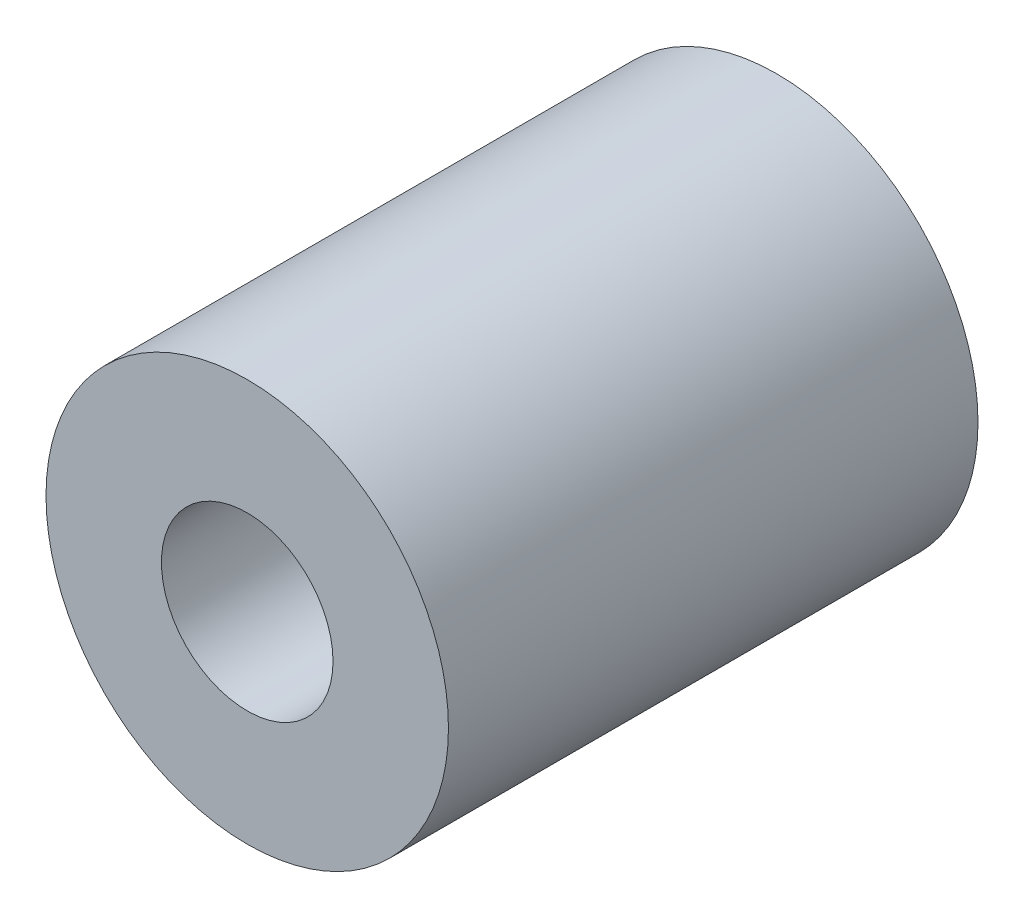
from build123d import *

# Parameters (mm, degrees)
CROQUIS1_R              = 9.5
SALIENTE_EXTRUIR1_DEPTH = 25
CROQUIS2_R              = 4.05
CORTAR_EXTRUIR1_DEPTH   = 29.381331893


with BuildPart() as part:
    # Croquis1 → Saliente-Extruir1 (new body)
    with BuildSketch(Plane.XY):
        Circle(CROQUIS1_R)
    extrude(amount=SALIENTE_EXTRUIR1_DEPTH)

    # Croquis2 → Cortar-Extruir1 (cut, through all)
    with BuildSketch(Plane.XY.offset(25)):
        Circle(CROQUIS2_R)
    extrude(amount=-CORTAR_EXTRUIR1_DEPTH, mode=Mode.SUBTRACT)


solid = part.part
